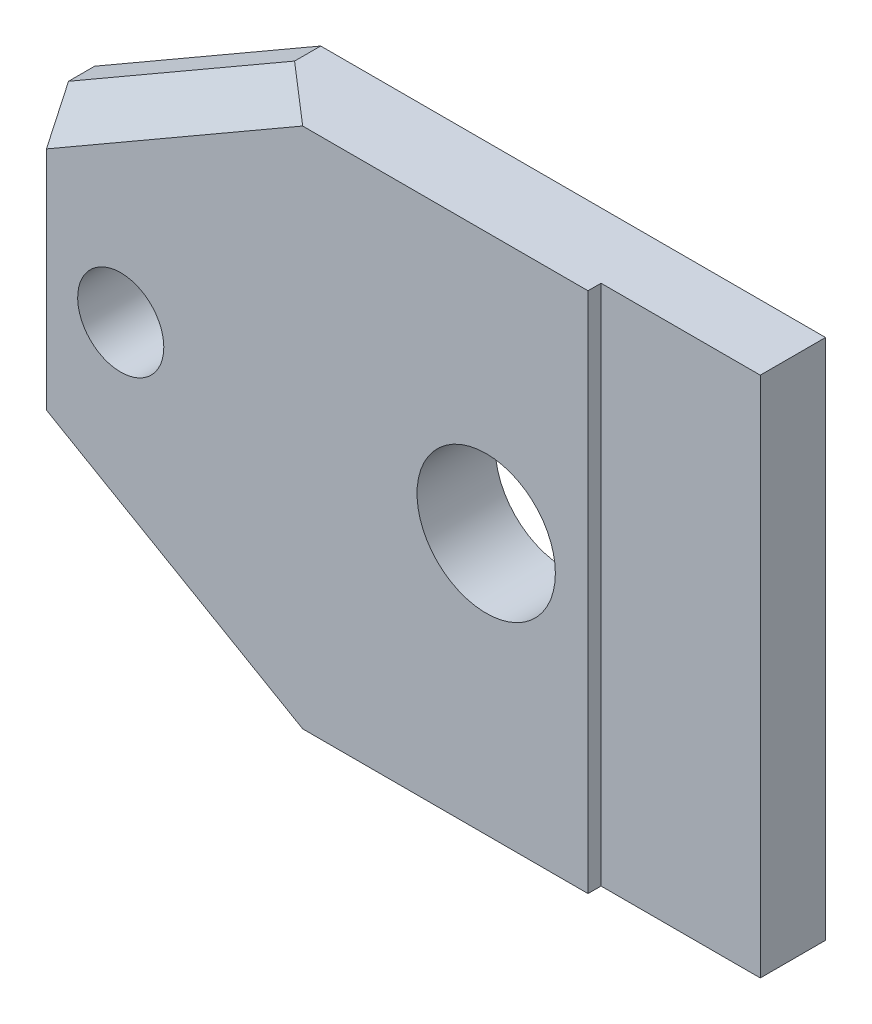
from build123d import *
from OCP.BRepFilletAPI import BRepFilletAPI_MakeChamfer

# Parameters (mm, degrees)
AUFSATZ_LINEAR_AUSTRAGEN1_DEPTH    = 20
SKIZZE2_R                          = 1.65
SKIZZE2_R_2                        = 2.65
SCHNITT_LINEAR_AUSTRAGEN1_DEPTH    = 3
FASE1_SIZE                         = 5
FASE1_SIZE2                        = 8.660254038
FASE2_SIZE                         = 2
FASE2_SIZE2                        = 1.154700538
K_RPER_VERSCHIEBEN_KOPIEREN1_ANGLE = 90


with BuildPart() as part:
    # Skizze1 → Aufsatz-Linear austragen1 (new body)
    with BuildSketch(Plane.XY):
        Polygon((0, 0), (28, 0), (28, 2.5), (21.9, 2.5), (21.9, 3), (0, 3), align=None)
    extrude(amount=AUFSATZ_LINEAR_AUSTRAGEN1_DEPTH)

    # Skizze2 → Schnitt-Linear austragen1 (cut)
    with BuildSketch(Plane.XZ):
        with Locations(Location((4, 10, 0), (0, 0, 270))):
            Circle(SKIZZE2_R)
        with Locations(Location((18, 10, 0), (0, 0, 270))):
            Circle(SKIZZE2_R_2)
    extrude(amount=-SCHNITT_LINEAR_AUSTRAGEN1_DEPTH, mode=Mode.SUBTRACT)

    # Fase1
    fase1_edges = [part.edges().sort_by_distance(p)[0] for p in [
        (0, 1.5, 20),
        (0, 1.5, 0),
    ]]
    fase1_side = [part.faces().sort_by_distance(p)[0] for p in [
        (0, 1.5, 10),
    ]]
    chamfer(fase1_edges, length=FASE1_SIZE, length2=FASE1_SIZE2, reference=fase1_side[0])

    # Fase2: one chamfer whose edges measure the first distance from different faces: ONE call of the kernel's chamfer builder (chamfer() names one face for all edges)
    fase2_edges_1 = [part.edges().sort_by_distance(p)[0] for p in [
        (0, 3, 10),
    ]]
    fase2_side_1 = [part.faces().sort_by_distance(p)[0] for p in [
        (0, 1.5, 10),
    ]]
    fase2_edges_2 = [part.edges().sort_by_distance(p)[0] for p in [
        (4.330127019, 3, 17.5),
    ]]
    fase2_side_2 = [part.faces().sort_by_distance(p)[0] for p in [
        (4.330127019, 1.5, 17.5),
    ]]
    fase2_edges_3 = [part.edges().sort_by_distance(p)[0] for p in [
        (4.330127019, 3, 2.5),
    ]]
    fase2_side_3 = [part.faces().sort_by_distance(p)[0] for p in [
        (4.330127019, 1.5, 2.5),
    ]]
    fase2 = BRepFilletAPI_MakeChamfer(part.part.solid().wrapped)
    for e in fase2_edges_1:
        fase2.Add(FASE2_SIZE, FASE2_SIZE2, e.wrapped, fase2_side_1[0].wrapped)  # the first distance lies on this face
    for e in fase2_edges_2:
        fase2.Add(FASE2_SIZE, FASE2_SIZE2, e.wrapped, fase2_side_2[0].wrapped)  # the first distance lies on this face
    for e in fase2_edges_3:
        fase2.Add(FASE2_SIZE, FASE2_SIZE2, e.wrapped, fase2_side_3[0].wrapped)  # the first distance lies on this face
    add(Compound.cast(fase2.Shape()), mode=Mode.REPLACE)


with BuildPart() as part_1:
    # Körper-Verschieben/Kopieren1: moved
    add(part.part.rotate(Axis((0, 1.5, 10), (1, 0, 0)), K_RPER_VERSCHIEBEN_KOPIEREN1_ANGLE))


solid = part_1.part
